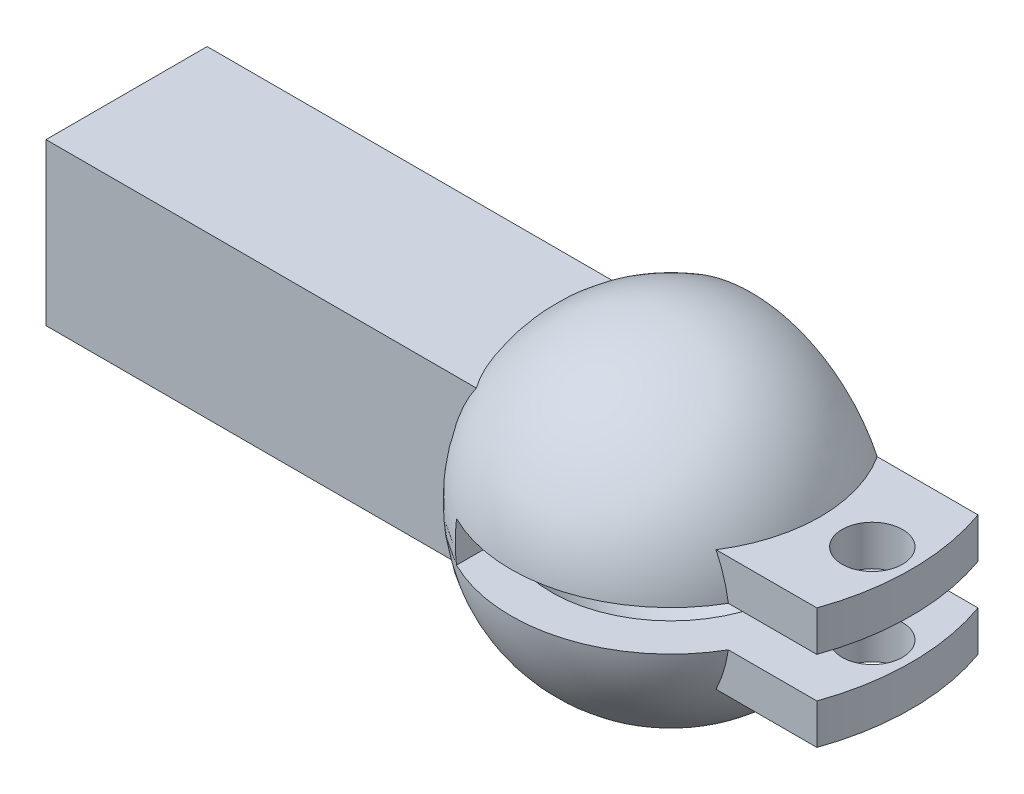
from build123d import *

# Parameters (mm, degrees)
RESSALTO_EXTRUS_O1_DEPTH    = 4
ESBO_O33_W                  = 8
ESBO_O33_H                  = 24.32835801
CORTE_EXTRUS_O20_DEPTH      = 59.436005136
CORTE_EXTRUS_O22_DEPTH      = 51.515563889
RESSALTO_EXTRUS_O14_DEPTH   = 4
ESBO_O38_R                  = 7
CORTE_EXTRUS_O23_DEPTH      = 39.915014679
ESBO_O39_W                  = 29.519685428
ESBO_O39_H                  = 8
CORTE_EXTRUS_O24_DEPTH      = 38.873187976
CORTE_EXTRUS_O25_DEPTH      = 39.915014679
CORTE_EXTRUS_O25_DEPTH_BACK = 39.915014679
ESBO_O40_W                  = 11.533486782
ESBO_O40_H                  = 2
CORTE_EXTRUS_O26_DEPTH      = 0.156854249
RESSALTO_EXTRUS_O15_START   = -1
RESSALTO_EXTRUS_O15_DEPTH   = 2
RESSALTO_EXTRUS_O16_START   = 2
RESSALTO_EXTRUS_O16_DEPTH   = 2
CORTE_EXTRUS_O27_DEPTH      = 43.203568046
CORTE_EXTRUS_O27_DEPTH_BACK = 43.203568046
ESBO_O44_R                  = 1.5


with BuildPart() as part:
    # Esboço1 → Ressalto-extrusão1 (new body)
    with BuildSketch(Plane.XY):
        with BuildLine():
            Line((40.514368641, 0), (48.514368641, 0))
            ThreePointArc((48.514368641, 0), (39.227067694, 12.823953684), (24.146045917, 8))
            Line((24.146045917, 8), (-21.519685428, 8))
            Line((-21.519685428, 8), (-21.519685428, 32.32835801))
            Line((-21.519685428, 32.32835801), (-29.519685428, 32.32835801))
            Line((-29.519685428, 32.32835801), (-29.519685428, 0))
            Line((-29.519685428, 0), (29.519685428, 0))
            ThreePointArc((29.519685428, 0), (35.017027034, 5.497341607), (40.514368641, 0))
        make_face()
    extrude(amount=RESSALTO_EXTRUS_O1_DEPTH)

    # Esboço33 → Corte-extrusão20 (cut, through all)
    with BuildSketch(Plane.XY.offset(4)):
        with Locations((-25.519685428, 20.164179005)):
            Rectangle(ESBO_O33_W, ESBO_O33_H)
    extrude(amount=-CORTE_EXTRUS_O20_DEPTH, mode=Mode.SUBTRACT)

    # Esboço34 → Corte-extrusão22 (cut, through all)
    with BuildSketch(Plane.XY.offset(4)):
        with BuildLine():
            Line((21.519685428, 0), (21.519685428, 8))
            Line((21.519685428, 8), (24.146045917, 8))
            ThreePointArc((24.146045917, 8), (39.227067694, 12.823953684), (48.514368641, 0))
            Line((48.514368641, 0), (40.514368641, 0))
            ThreePointArc((40.514368641, 0), (35.017027034, 5.497341607), (29.519685428, 0))
            Line((29.519685428, 0), (21.519685428, 0))
        make_face()
    extrude(amount=-CORTE_EXTRUS_O22_DEPTH, mode=Mode.SUBTRACT)

    # Esboço36 → Revolução1 (revolve)
    with BuildSketch(Plane.XY.offset(4)):
        with BuildLine():
            Line((27.019685428, -2), (27.019685428, -4))
            ThreePointArc((27.019685428, -4), (19.019685428, 4), (27.019685428, 12))
            Line((27.019685428, 12), (27.019685428, 10))
            ThreePointArc((27.019685428, 10), (21.019685428, 4), (27.019685428, -2))
        make_face()
    revolve(axis=Axis((27.019685428, -2, 4), (0, 1, 0)))

    # Esboço37 → Ressalto-extrusão14 (add)
    with BuildSketch(Plane.XY.offset(4)):
        with BuildLine():
            ThreePointArc((21.362831178, 8), (20.091482197, 4), (21.362831178, 0))
            Line((21.362831178, 0), (21.362831178, 8))
        make_face()
        with BuildLine():
            Line((20.091482197, 0), (21.362831178, 0))
            ThreePointArc((21.362831178, 0), (20.091482197, 4), (21.362831178, 8))
            Line((21.362831178, 8), (20.091482197, 8))
            Line((20.091482197, 8), (-29.519685428, 8))
            Line((-29.519685428, 8), (-29.519685428, 0))
            Line((-29.519685428, 0), (20.091482197, 0))
        make_face()
    extrude(amount=RESSALTO_EXTRUS_O14_DEPTH)

    # Esboço38 → Corte-extrusão23 (cut, through all)
    with BuildSketch(Plane(origin=(0, 0, 0), x_dir=(-1, 0, 0), z_dir=(0, 0, -1))):
        with Locations((-27.019685428, 4)):
            Circle(ESBO_O38_R)
    extrude(amount=CORTE_EXTRUS_O23_DEPTH, mode=Mode.SUBTRACT)

    # Esboço39 → Corte-extrusão24 (cut, through all)
    with BuildSketch(Plane.XY.offset(8)):
        with Locations((-14.759842714, 4)):
            Rectangle(ESBO_O39_W, ESBO_O39_H)
    extrude(amount=-CORTE_EXTRUS_O24_DEPTH, mode=Mode.SUBTRACT)

    # Esboço40 → Corte-extrusão25 (cut, two sides: drawn at the far end of the back side and taken through both)
    with BuildSketch(Plane(origin=(0, 0, 0), x_dir=(-1, 0, 0), z_dir=(0, 0, -1)).offset(-CORTE_EXTRUS_O25_DEPTH_BACK)):
        with Locations((-29.252942037, 4)):
            Rectangle(ESBO_O40_W, ESBO_O40_H)
    extrude(amount=CORTE_EXTRUS_O25_DEPTH + CORTE_EXTRUS_O25_DEPTH_BACK, mode=Mode.SUBTRACT)

    # Esboço41 → Corte-extrusão26 (cut)
    with BuildSketch(Plane(origin=(21.519685428, 0, 0), x_dir=(0, 0, -1), z_dir=(1, 0, 0))):
        with BuildLine():
            Line((-4, 6.397915762), (-4, 1.602084238))
            ThreePointArc((-4, 1.602084238), (-1.602084238, 4), (-4, 6.397915762))
        make_face()
    extrude(amount=-CORTE_EXTRUS_O26_DEPTH, mode=Mode.SUBTRACT)

    # Esboço42 → Ressalto-extrusão15 (add)
    with BuildSketch(Plane(origin=(0, 8, 0), x_dir=(1, 0, 0), z_dir=(0, 1, 0)).offset(RESSALTO_EXTRUS_O15_START)):
        with BuildLine():
            Line((32.597781304, 0), (38.266819794, 0))
            ThreePointArc((38.266819794, 0), (38.956939361, -4), (38.266819794, -8))
            Line((38.266819794, -8), (32.597781304, -8))
            ThreePointArc((32.597781304, -8), (33.88373333, -4), (32.597781304, 0))
        make_face()
    extrude(amount=-RESSALTO_EXTRUS_O15_DEPTH)

    # Esboço43 → Ressalto-extrusão16 (add)
    with BuildSketch(Plane.XZ.offset(-5).offset(RESSALTO_EXTRUS_O16_START)):
        with BuildLine():
            Line((38.266819794, 8), (33.264683426, 8))
            ThreePointArc((33.264683426, 8), (34.435883915, 4), (33.264683426, 0))
            Line((33.264683426, 0), (38.266819794, 0))
            ThreePointArc((38.266819794, 0), (38.956939361, 4), (38.266819794, 8))
        make_face()
    extrude(amount=RESSALTO_EXTRUS_O16_DEPTH)

    # Esboço44 → Corte-extrusão27 (cut, two sides: drawn at the far end of the back side and taken through both)
    with BuildSketch(Plane(origin=(0, 7, 0), x_dir=(1, 0, 0), z_dir=(0, 1, 0)).offset(-CORTE_EXTRUS_O27_DEPTH_BACK)):
        with Locations(Location((37.019685428, -4, 0), (0, 0, 90))):
            Circle(ESBO_O44_R)
    extrude(amount=CORTE_EXTRUS_O27_DEPTH + CORTE_EXTRUS_O27_DEPTH_BACK, mode=Mode.SUBTRACT)


solid = part.part
